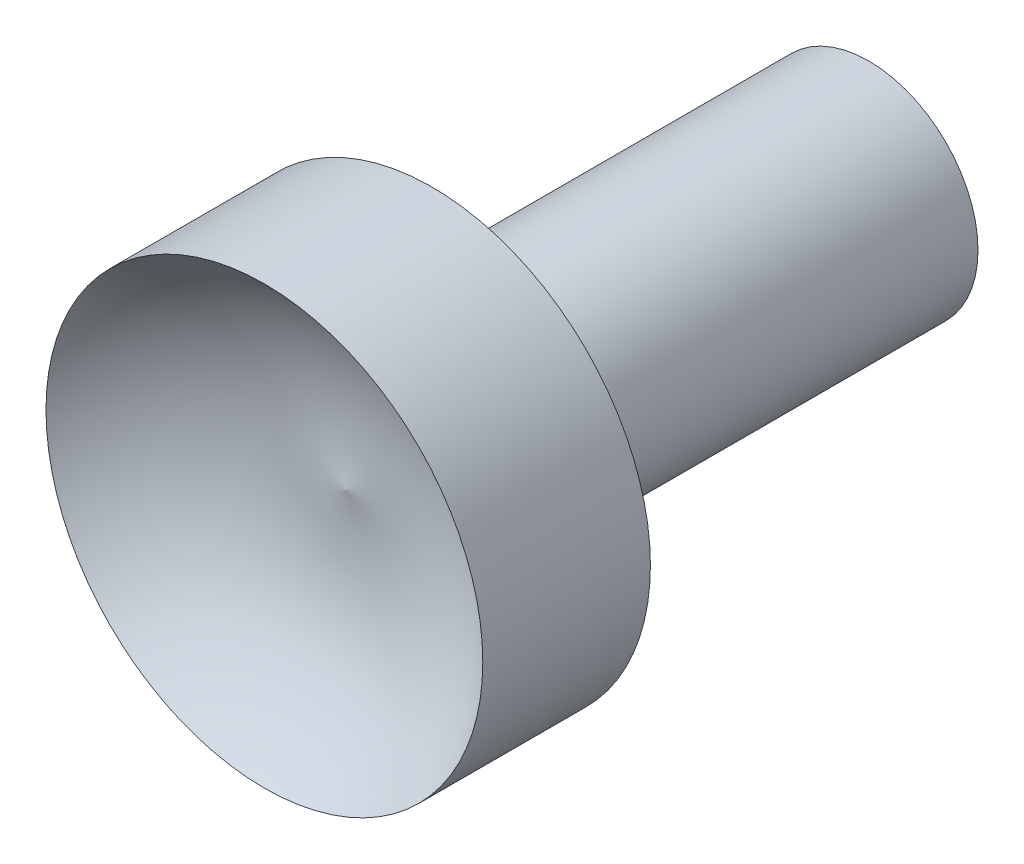
from build123d import *

# Parameters (mm, degrees)
SKETCH1_R           = 5
BOSS_EXTRUDE1_DEPTH = 6
SKETCH4_R           = 2.5
BOSS_EXTRUDE2_DEPTH = 10


with BuildPart() as part:
    # Sketch1 → Boss-Extrude1 (new body)
    with BuildSketch(Plane.XY):
        Circle(SKETCH1_R)
    extrude(amount=BOSS_EXTRUDE1_DEPTH)

    # Sketch3 → Cut-Revolve1 (revolve, cut)
    with BuildSketch(Plane(origin=(0, 0, 0), x_dir=(0, 0, -1), z_dir=(1, 0, 0)), mode=Mode.PRIVATE) as cut_revolve1_sk:
        with BuildLine():
            Line((-6, 0), (-9.957172865, 0))
            Line((-9.957172865, 0), (-9.957172865, 5.514350083))
            Line((-9.957172865, 5.514350083), (-9.957172865, 6))
            Line((-9.957172865, 6), (-6, 6))
            ThreePointArc((-6, 6), (-2.757359313, 3.828427125), (-2, 0))
            Line((-2, 0), (-6, 0))
        make_face()
    revolve(cut_revolve1_sk.sketch.rotate(Axis((0, 0, 0), (0, 0, 1)), 270), axis=Axis((0, 0, 0), (0, 0, 1)), mode=Mode.SUBTRACT)

    # Sketch4 → Boss-Extrude2 (add)
    with BuildSketch(Plane(origin=(0, 0, 0), x_dir=(-1, 0, 0), z_dir=(0, 0, -1))):
        with Locations(Location((0, 0, 0), (0, 0, 180))):
            Circle(SKETCH4_R)
    extrude(amount=BOSS_EXTRUDE2_DEPTH)


solid = part.part
